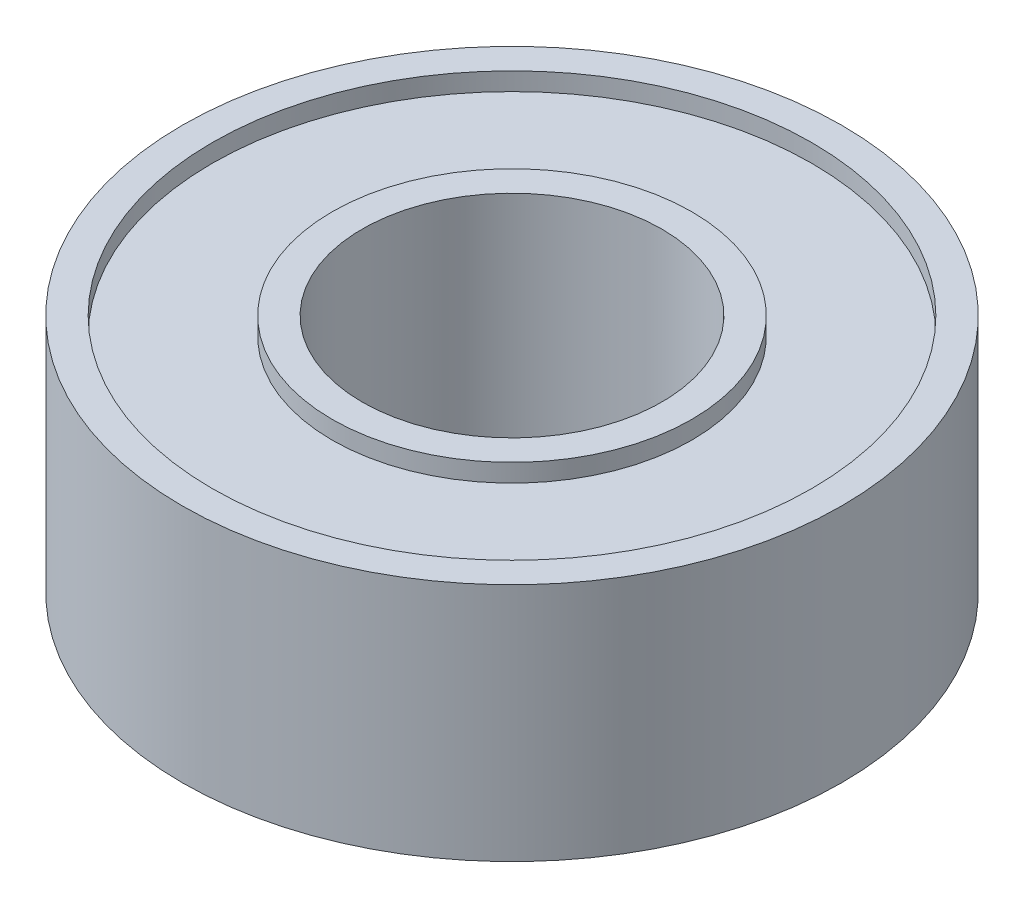
from build123d import *

# Parameters (mm, degrees)
SKETCH1_R           = 5.5
SKETCH1_R_2         = 2.5
BOSS_EXTRUDE1_DEPTH = 4
SKETCH2_R           = 5
SKETCH2_R_2         = 3
CUT_EXTRUDE1_DEPTH  = 0.3
CUT_EXTRUDE2_START  = -0.3
SKETCH3_R           = 5
SKETCH3_R_2         = 3
CUT_EXTRUDE2_DEPTH  = 0.3


with BuildPart() as part:
    # Sketch1 → Boss-Extrude1 (new body)
    with BuildSketch(Plane(origin=(0, 0, 0), x_dir=(1, 0, 0), z_dir=(0, 1, 0))):
        with Locations(Location((0, 0, 0), (0, 0, 270))):
            Circle(SKETCH1_R)
        with Locations(Location((0, 0, 0), (0, 0, 270))):
            Circle(SKETCH1_R_2, mode=Mode.SUBTRACT)
    extrude(amount=BOSS_EXTRUDE1_DEPTH)

    # Sketch2 → Cut-Extrude1 (cut)
    with BuildSketch(Plane(origin=(0, 4, 0), x_dir=(1, 0, 0), z_dir=(0, 1, 0))):
        with Locations(Location((0, 0, 0), (0, 0, 270))):
            Circle(SKETCH2_R)
        with Locations(Location((0, 0, 0), (0, 0, 270))):
            Circle(SKETCH2_R_2, mode=Mode.SUBTRACT)
    extrude(amount=-CUT_EXTRUDE1_DEPTH, mode=Mode.SUBTRACT)

    # Sketch3 → Cut-Extrude2 (cut)
    with BuildSketch(Plane.XZ.offset(CUT_EXTRUDE2_START)):
        with Locations(Location((0, 0, 0), (0, 0, 90))):
            Circle(SKETCH3_R)
        with Locations(Location((0, 0, 0), (0, 0, 90))):
            Circle(SKETCH3_R_2, mode=Mode.SUBTRACT)
    extrude(amount=CUT_EXTRUDE2_DEPTH, mode=Mode.SUBTRACT)


solid = part.part
